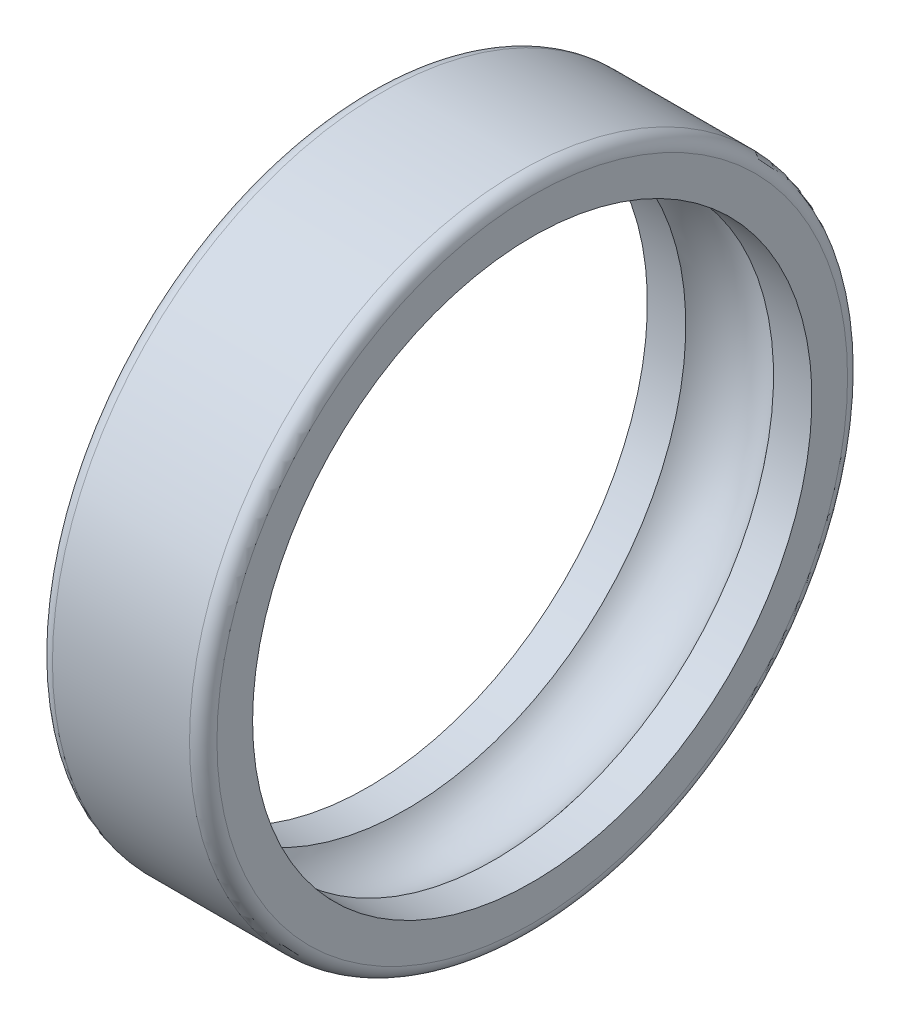
from build123d import *


with BuildPart() as part:
    # Esquisse1 → Base-Révolution (revolve)
    with BuildSketch(Plane.XY, mode=Mode.PRIVATE) as base_r_volution_sk:
        with BuildLine():
            Line((1.6, 10.2), (3, 10.2))
            Line((3, 10.2), (3, 11.5))
            ThreePointArc((3, 11.5), (2.853553391, 11.853553391), (2.5, 12))
            Line((2.5, 12), (-2.5, 12))
            ThreePointArc((-2.5, 12), (-2.853553391, 11.853553391), (-3, 11.5))
            Line((-3, 11.5), (-3, 10.2))
            Line((-3, 10.2), (-1.6, 10.2))
            ThreePointArc((-1.6, 10.2), (0, 11), (1.6, 10.2))
        make_face()
    revolve(base_r_volution_sk.sketch.rotate(Axis((-4.370908092, 0, 0), (1, 0, 0)), 90), axis=Axis((-4.370908092, 0, 0), (1, 0, 0)))


solid = part.part
